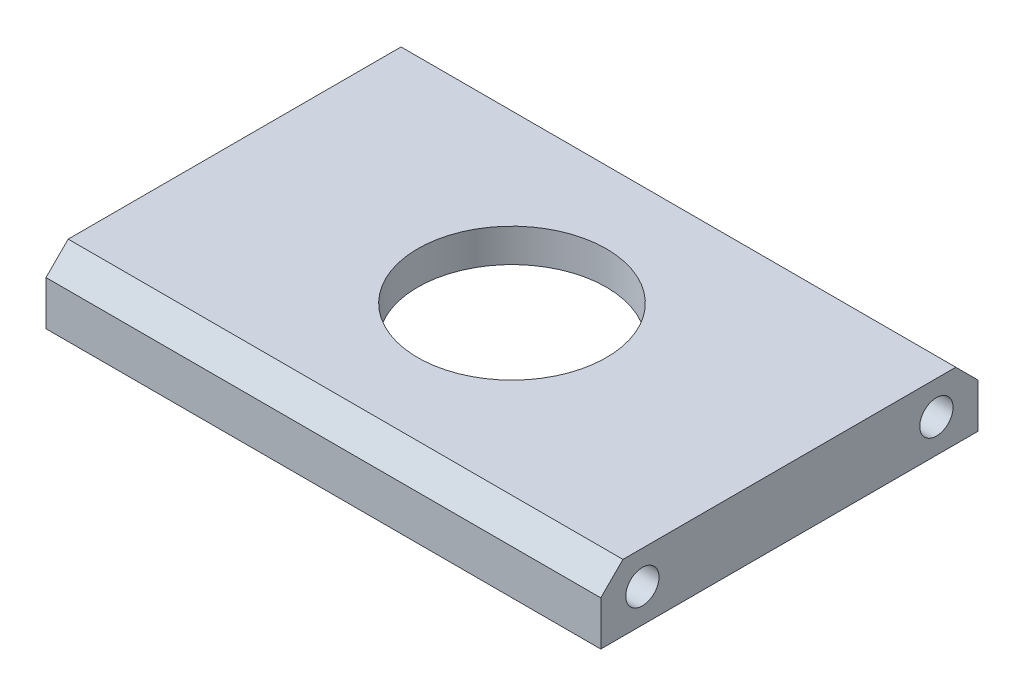
from build123d import *

# Parameters (mm, degrees)
SKETCH1_W           = 50
SKETCH1_H           = 34
BOSS_EXTRUDE1_DEPTH = 6
SKETCH2_R           = 1.5
CUT_EXTRUDE1_DEPTH  = 7
CUT_EXTRUDE2_START  = -7
SKETCH3_R           = 1.5
CUT_EXTRUDE2_DEPTH  = 7
CHAMFER1_SIZE       = 2
SKETCH4_R           = 15
CUT_EXTRUDE3_DEPTH  = 3
SKETCH5_R           = 8.5
CUT_EXTRUDE4_DEPTH  = 3


with BuildPart() as part:
    # Sketch1 → Boss-Extrude1 (new body)
    with BuildSketch(Plane(origin=(0, 0, 0), x_dir=(1, 0, 0), z_dir=(0, 1, 0))):
        with Locations((25, 17)):
            Rectangle(SKETCH1_W, SKETCH1_H)
    extrude(amount=BOSS_EXTRUDE1_DEPTH)

    # Sketch2 → Cut-Extrude1 (cut)
    with BuildSketch(Plane(origin=(50, 0, 0), x_dir=(0, 0, -1), z_dir=(1, 0, 0))):
        with Locations((3.75, 3)):
            Circle(SKETCH2_R)
        with Locations((30.25, 3)):
            Circle(SKETCH2_R)
    extrude(amount=-CUT_EXTRUDE1_DEPTH, mode=Mode.SUBTRACT)

    # Sketch3 → Cut-Extrude2 (cut)
    with BuildSketch(Plane.ZY.offset(CUT_EXTRUDE2_START)):
        with Locations(Location((-30.25, 3, 0), (0, 0, 180))):
            Circle(SKETCH3_R)
        with Locations(Location((-3.75, 3, 0), (0, 0, 180))):
            Circle(SKETCH3_R)
    extrude(amount=CUT_EXTRUDE2_DEPTH, mode=Mode.SUBTRACT)

    # Chamfer1
    chamfer1_edges = [part.edges().sort_by_distance(p)[0] for p in [
        (25, 6, -34),
        (25, 6, 0),
    ]]
    chamfer(chamfer1_edges, length=CHAMFER1_SIZE)

    # Sketch4 → Cut-Extrude3 (cut)
    with BuildSketch(Plane.XZ):
        with Locations(Location((25, -17, 0), (0, 0, 270))):
            Circle(SKETCH4_R)
    extrude(amount=-CUT_EXTRUDE3_DEPTH, mode=Mode.SUBTRACT)

    # Sketch5 → Cut-Extrude4 (cut)
    with BuildSketch(Plane.XZ.offset(-3)):
        with Locations(Location((25, -17, 0), (0, 0, 270))):
            Circle(SKETCH5_R)
    extrude(amount=-CUT_EXTRUDE4_DEPTH, mode=Mode.SUBTRACT)


solid = part.part
